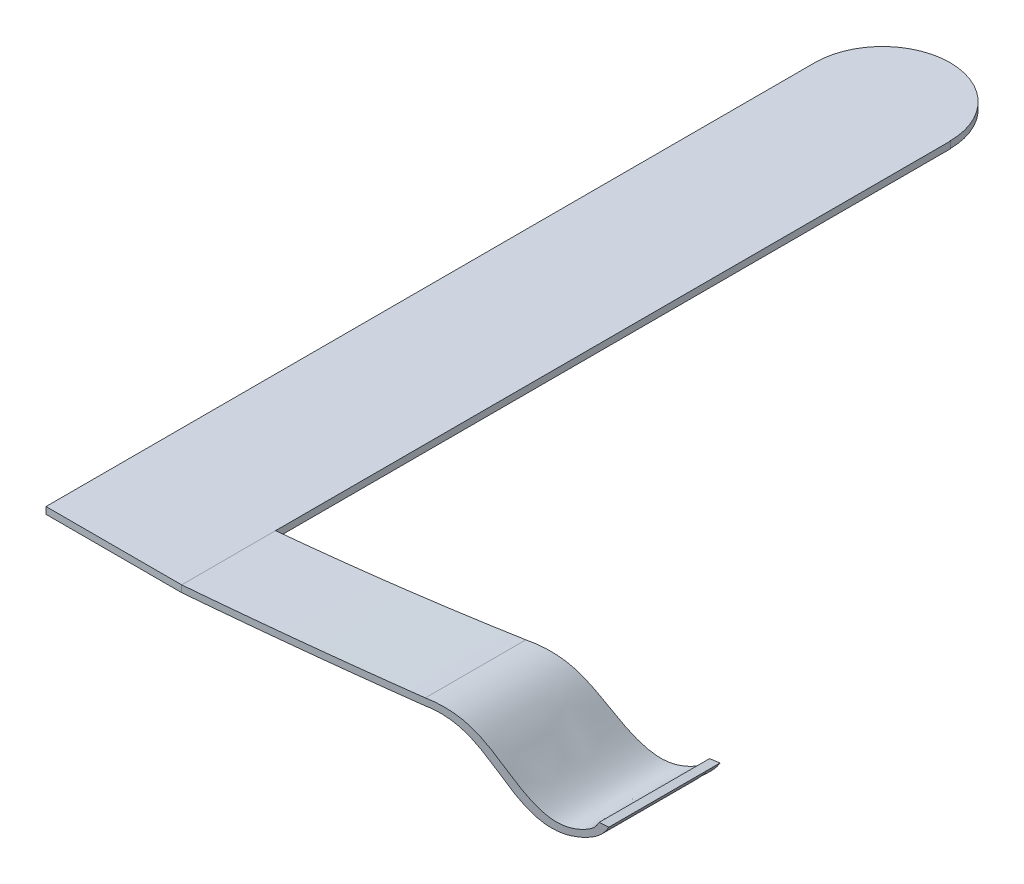
from build123d import *

# Parameters (mm, degrees)
EXTRUDE_1_DEPTH     = 17
EXTRUDE_2_DEPTH     = 2.49
CUT_EXTRUDE_1_DEPTH = 20
EXTRUDE_START       = -0.15
EXTRUDE_3_DEPTH     = 0.15


with BuildPart() as part:
    # Эскиз1 → Бобышка-Вытянуть1 (new body)
    with BuildSketch(Plane.XY):
        Polygon((0.003538245, 30.6), (-1.496461755, 30.6), (-1.496461755, 30.45), (1.503538245, 30.45), (1.503538245, 30.6), align=None)
    extrude(amount=EXTRUDE_1_DEPTH)

    # Эскиз5 → Бобышка-Вытянуть2 (add)
    with BuildSketch(Plane(origin=(0, 28.11, 0), x_dir=(1, 0, 0), z_dir=(0, 1, 0))):
        with BuildLine():
            Line((1.503538245, -17), (1.503538245, -14.924455526))
            ThreePointArc((1.503538245, -14.924455526), (5.831161676, -13.82018645), (9.641814145, -11.490666647))
            Line((9.641814145, -11.490666647), (10.970044442, -13.073589874))
            ThreePointArc((10.970044442, -13.073589874), (6.538481504, -15.764164642), (1.503538245, -17))
        make_face()
    extrude(amount=EXTRUDE_2_DEPTH)

    # Эскиз6 → Вырез-Вытянуть1 (cut)
    with BuildSketch(Plane.XY.offset(17)):
        with BuildLine():
            Line((8.521891089, 28.454295213), (8.657616092, 28.390430328))
            add(Edge.make_bspline(
                [(5.879100066, 29.993881439), (6.307843904, 29.938106152), (7.018632939, 29.280475664), (7.690192817, 27.91817908), (8.518003244, 28.170685992), (8.619480263, 28.313699251), (8.648312773, 28.370659008), (8.657616092, 28.390430328)],
                knots=[0, 0, 0, 0, 0.289830958, 0.733667508, 0.815431682, 0.844658315, 0.859635275, 0.859635275, 0.859635275, 0.859635275], degree=3))
            add(Edge.make_bspline(
                [(1.503538245, 30.45), (3.715560515, 30.449991161), (5.879100066, 29.993881439)],
                knots=[0, 0, 0, 1, 1, 1], degree=2))
            Line((1.503538245, 30.45), (1.503538245, 27.864618801))
            Line((1.503538245, 27.864618801), (11.162487636, 27.864618801))
            Line((11.162487636, 27.864618801), (11.137034926, 30.6))
            Line((11.137034926, 30.6), (1.503538844, 30.6))
            add(Edge.make_bspline(
                [(1.503538844, 30.6), (2.978432971, 30.599994106), (4.461182915, 30.445697761), (5.904436507, 30.141836357)],
                knots=[0, 0, 0, 0, 0.998713484, 0.998713484, 0.998713484, 0.998713484], degree=3))
            add(Edge.make_bspline(
                [(5.904436507, 30.141836357), (6.070149185, 30.119558607), (6.403177783, 30.003980968), (6.882223314, 29.594639274), (7.348965788, 28.842434324), (7.801409568, 28.335118852), (8.109877777, 28.252654256), (8.290556261, 28.257818329), (8.426320035, 28.314903679), (8.476599406, 28.368493987), (8.509251117, 28.427432873), (8.521891089, 28.454295213)],
                knots=[0.001207455, 0.001207455, 0.001207455, 0.001207455, 0.108510933, 0.21581441, 0.430421365, 0.64502832, 0.698680058, 0.752331797, 0.805983536, 0.832809405, 0.859635275, 0.859635275, 0.859635275, 0.859635275], degree=3))
        make_face()
    extrude(amount=-CUT_EXTRUDE_1_DEPTH, mode=Mode.SUBTRACT)

    # Эскиз7 → Бобышка-Вытянуть3 (add)
    with BuildSketch(Plane(origin=(0, 30.6, 0), x_dir=(1, 0, 0), z_dir=(0, 1, 0)).offset(EXTRUDE_START)):
        with BuildLine():
            Line((-1.496461755, 0), (1.496461755, 0))
            ThreePointArc((1.496461755, 0), (0, 1.496461755), (-1.496461755, 0))
        make_face()
    extrude(amount=EXTRUDE_3_DEPTH)


solid = part.part
